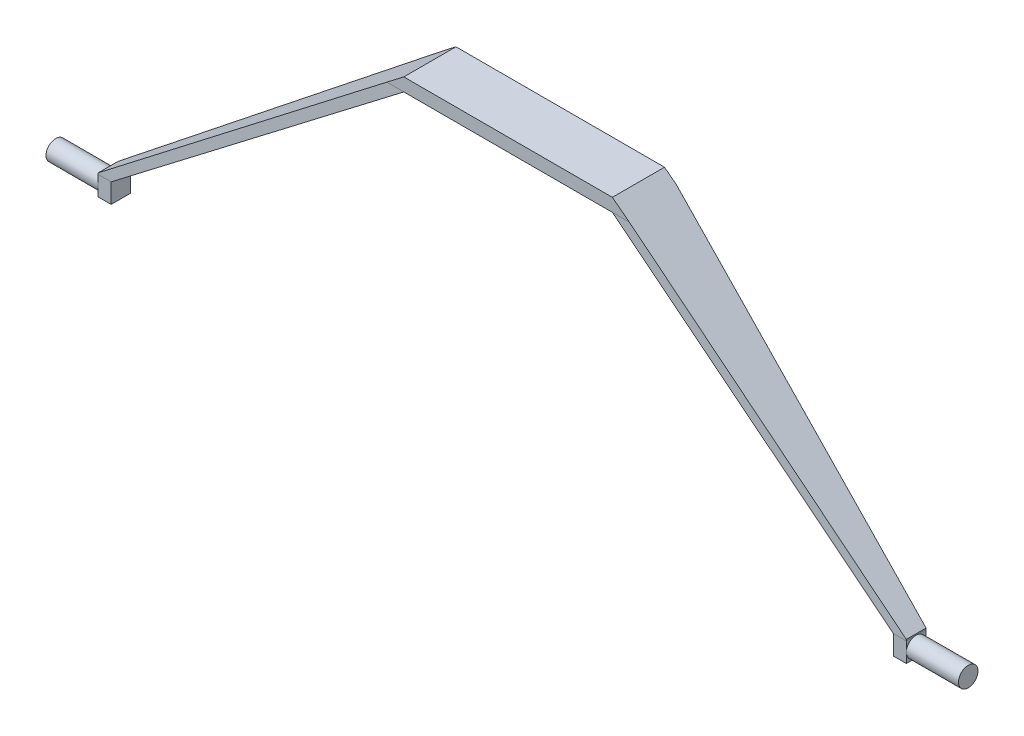
from build123d import *

# Parameters (mm, degrees)
BOSS_EXTRUDE1_DEPTH            = 11.43
BOSS_EXTRUDE1_DEPTH_BACK       = 101.6
SKETCH2_R                      = 19.05
BOSS_EXTRUDE2_DEPTH            = 101.6
CUT_EXTRUDE2_REACH             = 930.494
CUT_EXTRUDE2_DIRECTION_2_REACH = 930.494
CUT_EXTRUDE3_REACH             = 930.494
CUT_EXTRUDE3_DIRECTION_2_REACH = 930.494


with BuildPart() as part:
    # Sketch1 → Boss-Extrude1 (new, two sides: drawn at the far end of the back side and taken through both)
    with BuildSketch(Plane.XY.offset(-BOSS_EXTRUDE1_DEPTH_BACK)):
        Polygon((-787.4, -209.55), (-787.471663752, -247.65), (-762.071663752, -247.65), (-762.071663752, -209.55), (-203.2, 215.9), (0, 215.9), (0, 241.3), (-203.2, 241.3), (-787.4, -207.01), align=None)
        Polygon((0, 241.3), (0, 215.9), (203.2, 215.9), (762.071663752, -209.55), (762.071663752, -247.65), (787.471663752, -247.65), (787.4, -209.55), (787.4, -207.01), (203.2, 241.3), align=None)
    extrude(amount=BOSS_EXTRUDE1_DEPTH + BOSS_EXTRUDE1_DEPTH_BACK)

    # Sketch2 → Boss-Extrude2 (add)
    with BuildSketch(Plane(origin=(-787.003065002, 1.480304267, 0), x_dir=(0, 0, 1), z_dir=(-0.9999982310401075, 0.0018809350483380617, 0))):
        with Locations(Location((-7.62, -230.080744969, 0), (0, 0, 270))):
            Circle(SKETCH2_R)
    boss_extrude2 = extrude(amount=BOSS_EXTRUDE2_DEPTH)

    # Mirror1: Boss-Extrude2 across plane
    add(boss_extrude2.mirror(Plane(origin=(0, 0, 0), x_dir=(0, 0, 1), z_dir=(1, 0, 0))))

    # Sketch5 → Cut-Extrude2 (cut, up to next)
    with BuildSketch(Plane(origin=(0, 0, 0), x_dir=(0, 0, -1), z_dir=(1, 0, 0)), mode=Mode.PRIVATE) as cut_extrude2_sk1:
        Polygon((-11.43, -209.55), (0, 215.9), (0, 241.3), (-11.43, 241.3), (-11.43, 215.9), align=None)
    cut_extrude2_tool1 = extrude(cut_extrude2_sk1.sketch, amount=-CUT_EXTRUDE2_REACH, mode=Mode.PRIVATE) & part.part
    add(cut_extrude2_tool1.solids().sort_by_distance((0, 90.565111, 7.4168))[0], mode=Mode.SUBTRACT)

    # Sketch5 → Cut-Extrude2 direction 2 (cut, up to next)
    with BuildSketch(Plane(origin=(0, 0, 0), x_dir=(0, 0, -1), z_dir=(1, 0, 0)), mode=Mode.PRIVATE) as cut_extrude2_direction_2_sk1:
        Polygon((-11.43, -209.55), (0, 215.9), (0, 241.3), (-11.43, 241.3), (-11.43, 215.9), align=None)
    cut_extrude2_direction_2_tool1 = extrude(cut_extrude2_direction_2_sk1.sketch, amount=CUT_EXTRUDE2_DIRECTION_2_REACH, mode=Mode.PRIVATE) & part.part
    add(cut_extrude2_direction_2_tool1.solids().sort_by_distance((0, 90.565111, 7.4168))[0], mode=Mode.SUBTRACT)

    # Sketch7 → Cut-Extrude3 (cut, up to next)
    with BuildSketch(Plane(origin=(0, 0, 0), x_dir=(0, 0, -1), z_dir=(1, 0, 0)), mode=Mode.PRIVATE) as cut_extrude3_sk1:
        Polygon((26.67, -209.55), (101.6, 223.982414479), (101.6, -247.65), (26.67, -247.65), align=None)
    cut_extrude3_tool1 = extrude(cut_extrude3_sk1.sketch, amount=-CUT_EXTRUDE3_REACH, mode=Mode.PRIVATE) & part.part
    add(cut_extrude3_tool1.solids().sort_by_distance((0, -89.489932, -74.75645))[0], mode=Mode.SUBTRACT)

    # Sketch7 → Cut-Extrude3 direction 2 (cut, up to next)
    with BuildSketch(Plane(origin=(0, 0, 0), x_dir=(0, 0, -1), z_dir=(1, 0, 0)), mode=Mode.PRIVATE) as cut_extrude3_direction_2_sk1:
        Polygon((26.67, -209.55), (101.6, 223.982414479), (101.6, -247.65), (26.67, -247.65), align=None)
    cut_extrude3_direction_2_tool1 = extrude(cut_extrude3_direction_2_sk1.sketch, amount=CUT_EXTRUDE3_DIRECTION_2_REACH, mode=Mode.PRIVATE) & part.part
    add(cut_extrude3_direction_2_tool1.solids().sort_by_distance((0, -89.489932, -74.75645))[0], mode=Mode.SUBTRACT)


solid = part.part
